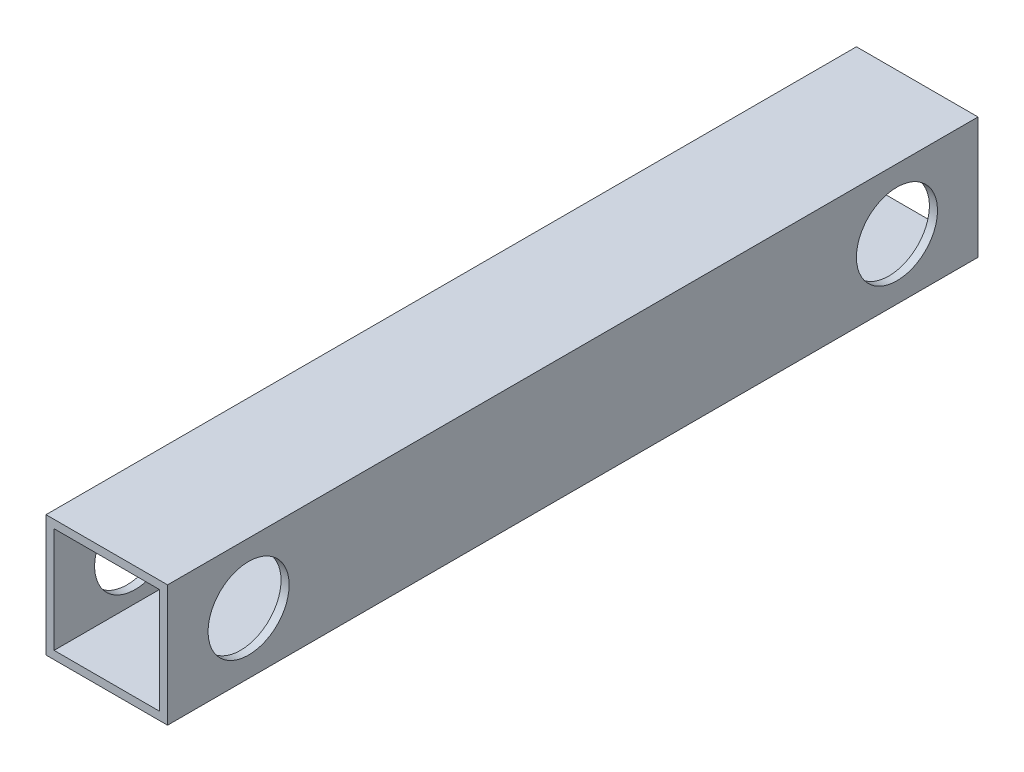
from build123d import *

# Parameters (mm, degrees)
SKETCH1_W           = 30
SKETCH1_H           = 30
SKETCH1_W_2         = 26
SKETCH1_H_2         = 26
BOSS_EXTRUDE1_DEPTH = 200
SKETCH2_R           = 10
CUT_EXTRUDE1_DEPTH  = 200


with BuildPart() as part:
    # Sketch1 → Boss-Extrude1 (new body)
    with BuildSketch(Plane.XY):
        Rectangle(SKETCH1_W, SKETCH1_H)
        Rectangle(SKETCH1_W_2, SKETCH1_H_2, mode=Mode.SUBTRACT)
    extrude(amount=BOSS_EXTRUDE1_DEPTH)

    # Sketch2 → Cut-Extrude1 (cut)
    with BuildSketch(Plane(origin=(15, 0, 0), x_dir=(0, 0, -1), z_dir=(1, 0, 0))):
        with Locations((-180, 0)):
            Circle(SKETCH2_R)
        with Locations((-20, 0)):
            Circle(SKETCH2_R)
    extrude(amount=-CUT_EXTRUDE1_DEPTH, mode=Mode.SUBTRACT)


solid = part.part
